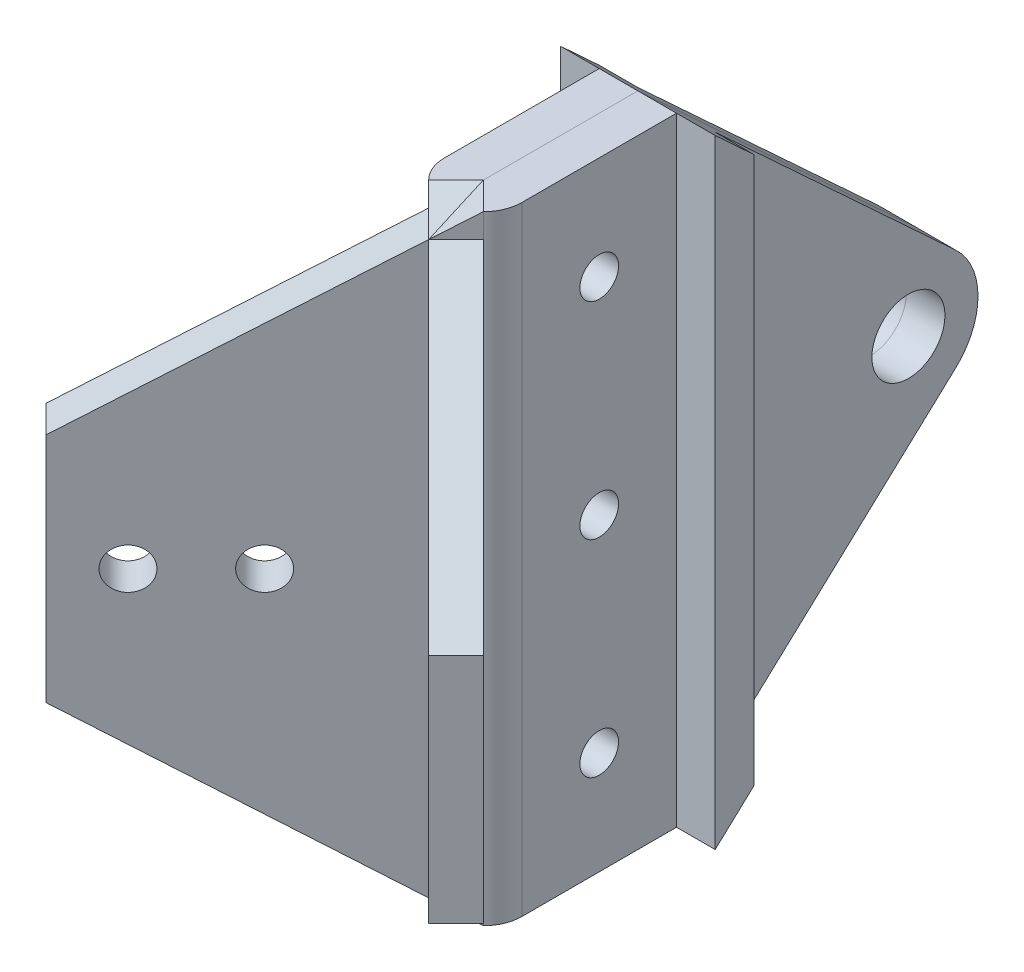
from build123d import *

# Parameters (mm, degrees)
SKETCH1_W           = 25.4
SKETCH1_H           = 101.6
SKETCH1_R           = 3.175
BOSS_EXTRUDE1_DEPTH = 6.35
BOSS_EXTRUDE2_DEPTH = 12.7
BOSS_EXTRUDE3_DEPTH = 101.6
CUT_EXTRUDE1_DEPTH  = 1015.748334056
CUT_EXTRUDE4_DEPTH  = 1015.748334056


with BuildPart() as part:
    # Sketch1 → Boss-Extrude1 (new body)
    # profile 1 of 7: a face of its own
    with BuildSketch(Plane(origin=(0, 0, 0), x_dir=(0, 0, -1), z_dir=(1, 0, 0))):
        with BuildLine():
            Line((1398.423242973, 108.323129495), (1362.627423264, 141.42442982))
            Line((1362.627423264, 141.42442982), (1362.627423264, 51.568441203))
            Line((1362.627423264, 51.568441203), (1395.68444407, 82.137104875))
            Line((1395.68444407, 82.137104875), (1389.154234775, 85.14044675))
            add(Edge.make_bspline(
                [(1398.423242973, 108.323129495), (1387.739315105, 111.977739505), (1383.021002085, 101.719425118), (1377.797813595, 90.363436356), (1389.154234775, 85.14044675)],
                knots=[1.250204036, 1.250204036, 1.250204036, 2.710509531, 2.710509531, 4.281305858, 4.281305858, 4.281305858], degree=2, weights=[0.96169376, 0.72770908, 1, 0.707106781, 1]))
        make_face()
    # profile 2 of 7: a face of its own
    with BuildSketch(Plane(origin=(0, 0, 0), x_dir=(0, 0, -1), z_dir=(1, 0, 0))):
        with BuildLine():
            Line((1402.137630748, 104.888341124), (1398.423242973, 108.323129495))
            add(Edge.make_bspline(
                [(1398.423242973, 108.323129495), (1387.739315105, 111.977739505), (1383.021002085, 101.719425118), (1377.797813595, 90.363436356), (1389.154234775, 85.14044675)],
                knots=[1.250204036, 1.250204036, 1.250204036, 2.710509531, 2.710509531, 4.281305858, 4.281305858, 4.281305858], degree=2, weights=[0.96169376, 0.72770908, 1, 0.707106781, 1]))
            Line((1389.154234775, 85.14044675), (1395.68444407, 82.137104875))
            Line((1395.68444407, 82.137104875), (1402.028477486, 88.003593115))
            Line((1402.028477486, 88.003593115), (1402.029499743, 88.005815653))
            ThreePointArc((1402.029499743, 88.005815653), (1382.947657703, 96.569642096), (1402.137630748, 104.888341124))
        make_face()
    # profile 3 of 7: a face of its own
    with BuildSketch(Plane(origin=(0, 0, 0), x_dir=(0, 0, -1), z_dir=(1, 0, 0))):
        with BuildLine():
            ThreePointArc((1405.807423264, 96.496435511), (1404.849864993, 101.076049494), (1402.137630748, 104.888341124))
            ThreePointArc((1402.137630748, 104.888341124), (1382.947657703, 96.569642096), (1402.029499743, 88.005815653))
            Line((1402.029499743, 88.005815653), (1405.803880671, 96.211881257))
            ThreePointArc((1405.803880671, 96.211881257), (1405.806537582, 96.354147359), (1405.807423264, 96.496435511))
        make_face()
        with BuildLine():
            add(Edge.make_bspline(
                [(1388.377423264, 96.496435511), (1388.377423264, 86.104526373), (1397.377423264, 91.300480942), (1406.377423264, 96.496435511), (1397.377423264, 101.69239008), (1388.377423264, 106.888344649), (1388.377423264, 96.496435511)],
                knots=[0, 0, 0, 2.094395102, 2.094395102, 4.188790205, 4.188790205, 6.283185307, 6.283185307, 6.283185307], degree=2, weights=[1, 0.5, 1, 0.5, 1, 0.5, 1]))
        make_face(mode=Mode.SUBTRACT)
    # profile 4 of 7: a face of its own
    with BuildSketch(Plane(origin=(0, 0, 0), x_dir=(0, 0, -1), z_dir=(1, 0, 0))):
        with BuildLine():
            Line((1405.803880671, 96.211881257), (1402.029499743, 88.005815653))
            ThreePointArc((1402.029499743, 88.005815653), (1402.083723308, 88.054999635), (1402.137630748, 88.104529898))
            ThreePointArc((1402.137630748, 88.104529898), (1404.792043465, 91.786808554), (1405.803880671, 96.211881257))
        make_face()
    # profile 5 of 7: a face of its own
    with BuildSketch(Plane(origin=(0, 0, 0), x_dir=(0, 0, -1), z_dir=(1, 0, 0))):
        with BuildLine():
            ThreePointArc((1402.137630748, 88.104529898), (1402.083723308, 88.054999635), (1402.029499743, 88.005815653))
            Line((1402.029499743, 88.005815653), (1402.028477486, 88.003593115))
            Line((1402.028477486, 88.003593115), (1402.137630748, 88.104529898))
        make_face()
    # profile 6 of 7: a face of its own
    with BuildSketch(Plane(origin=(0, 0, 0), x_dir=(0, 0, -1), z_dir=(1, 0, 0))):
        Polygon((1362.627423264, 51.568441203), (1362.627423264, 141.42442982), (1356.277423264, 147.296435511), (1356.277423264, 45.696435511), align=None)
    # profile 7 of 7: a face of its own
    with BuildSketch(Plane(origin=(0, 0, 0), x_dir=(0, 0, -1), z_dir=(1, 0, 0))):
        with Locations((1343.577423264, 96.496435511)):
            Rectangle(SKETCH1_W, SKETCH1_H)
        with Locations((1343.577423264, 96.496435511)):
            Circle(SKETCH1_R, mode=Mode.SUBTRACT)
        with Locations((1343.577423264, 130.363102178)):
            Circle(SKETCH1_R, mode=Mode.SUBTRACT)
        with Locations((1343.577423264, 62.629768844)):
            Circle(SKETCH1_R, mode=Mode.SUBTRACT)
    extrude(amount=BOSS_EXTRUDE1_DEPTH)

    # Sketch1<4> → Boss-Extrude2 (add)
    with BuildSketch(Plane(origin=(0, 0, 0), x_dir=(0, 0, -1), z_dir=(1, 0, 0))):
        Polygon((1362.627423264, 51.568441203), (1362.627423264, 141.42442982), (1356.277423264, 147.296435511), (1356.277423264, 45.696435511), align=None)
    extrude(amount=BOSS_EXTRUDE2_DEPTH)

    # Sketch2 → Boss-Extrude3 (add)
    with BuildSketch(Plane.XZ.offset(-45.696435511)):
        with BuildLine():
            Line((-35.921024484, -1294.95639878), (0, -1330.877423264))
            Line((0, -1330.877423264), (6.35, -1330.877423264))
            ThreePointArc((6.35, -1330.877423264), (5.866635031, -1328.447383469), (4.490128061, -1326.387295204))
            Line((4.490128061, -1326.387295204), (-31.430896424, -1290.46627072))
            Line((-31.430896424, -1290.46627072), (-35.921024484, -1294.95639878))
        make_face()
    extrude(amount=-BOSS_EXTRUDE3_DEPTH)

    # Sketch3 → Cut-Extrude1 (cut, through all)
    with BuildSketch(Plane(origin=(-665.438711632, 0, -665.438711632), x_dir=(-0.7071067811865446, 0, 0.7071067811865505), z_dir=(-0.7071067811865505, 0, -0.7071067811865446))):
        Polygon((-890.272450918, 147.296435511), (-941.072450918, 147.296435511), (-890.272450918, 115.546435511), align=None)
        Polygon((-890.272450918, 45.696435511), (-890.272450918, 77.446435511), (-941.072450918, 45.696435511), align=None)
    extrude(amount=-CUT_EXTRUDE1_DEPTH, mode=Mode.SUBTRACT)

    # Sketch7 → Cut-Extrude4 (cut, through all)
    with BuildSketch(Plane(origin=(-665.438711632, 0, -665.438711632), x_dir=(-0.7071067811865439, 0, 0.7071067811865511), z_dir=(-0.7071067811865511, 0, -0.7071067811865439))):
        with BuildLine():
            ThreePointArc((-912.299013418, 96.496435511), (-915.672450918, 99.869873011), (-919.045888418, 96.496435511))
            Line((-919.045888418, 96.496435511), (-912.299013418, 96.496435511))
        make_face()
        with BuildLine():
            Line((-912.299013418, 96.496435511), (-919.045888418, 96.496435511))
            ThreePointArc((-919.045888418, 96.496435511), (-915.672450918, 93.122998011), (-912.299013418, 96.496435511))
        make_face()
        with BuildLine():
            ThreePointArc((-903.170888418, 96.496435511), (-899.797450918, 93.122998011), (-896.424013418, 96.496435511))
            Line((-896.424013418, 96.496435511), (-903.170888418, 96.496435511))
        make_face()
        with BuildLine():
            Line((-903.170888418, 96.496435511), (-896.424013418, 96.496435511))
            ThreePointArc((-896.424013418, 96.496435511), (-899.797450918, 99.869873011), (-903.170888418, 96.496435511))
        make_face()
    extrude(amount=-CUT_EXTRUDE4_DEPTH, mode=Mode.SUBTRACT)


with BuildPart() as body_2:
    # Mirror1: mirrored copy
    add(part.part.mirror(Plane(origin=(0, 0, 0), x_dir=(0, 0, 1), z_dir=(1, 0, 0))))


solid = Compound([part.part, body_2.part])
